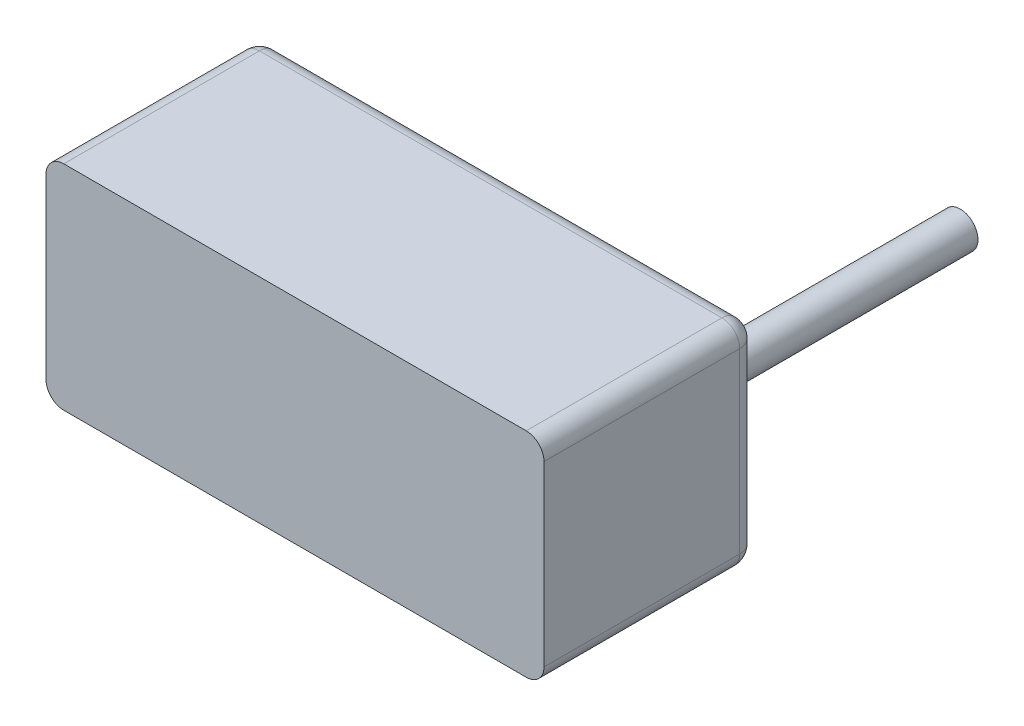
from build123d import *

# Parameters (mm, degrees)
SKETCH1_W           = 177.8
SKETCH1_H           = 76.2
BOSS_EXTRUDE1_DEPTH = 76.2
FILLET1_R           = 6.35
SKETCH2_R           = 6.35
BOSS_EXTRUDE2_DEPTH = 101.6
FILLET2_R           = 6.35


with BuildPart() as part:
    # Sketch1 → Boss-Extrude1 (new body)
    with BuildSketch(Plane(origin=(0, 0, 0), x_dir=(1, 0, 0), z_dir=(0, 1, 0))):
        Rectangle(SKETCH1_W, SKETCH1_H)
    extrude(amount=BOSS_EXTRUDE1_DEPTH)

    # Fillet1
    fillet1_edges = [part.edges().sort_by_distance(p)[0] for p in [
        (88.9, 76.2, 0),
        (-88.9, 76.2, 0),
        (88.9, 0, 0),
        (-88.9, 0, 0),
    ]]
    fillet(fillet1_edges, radius=FILLET1_R)

    # Sketch2 → Boss-Extrude2 (add)
    with BuildSketch(Plane(origin=(0, 0, -38.1), x_dir=(-1, 0, 0), z_dir=(0, 0, -1))):
        with Locations(Location((-59.69, 38.1, 0), (0, 0, 180))):
            Circle(SKETCH2_R)
    extrude(amount=BOSS_EXTRUDE2_DEPTH)

    # Fillet2
    fillet2_edges = [part.edges().sort_by_distance(p)[0] for p in [
        (-88.9, 38.1, -38.1),
        (0, 0, -38.1),
        (0, 76.2, -38.1),
        (88.9, 38.1, -38.1),
        (87.040128061, 74.340128061, -38.1),
        (-87.040128061, 74.340128061, -38.1),
        (87.040128061, 1.859871939, -38.1),
        (-87.040128061, 1.859871939, -38.1),
    ]]
    fillet(fillet2_edges, radius=FILLET2_R)


solid = part.part
